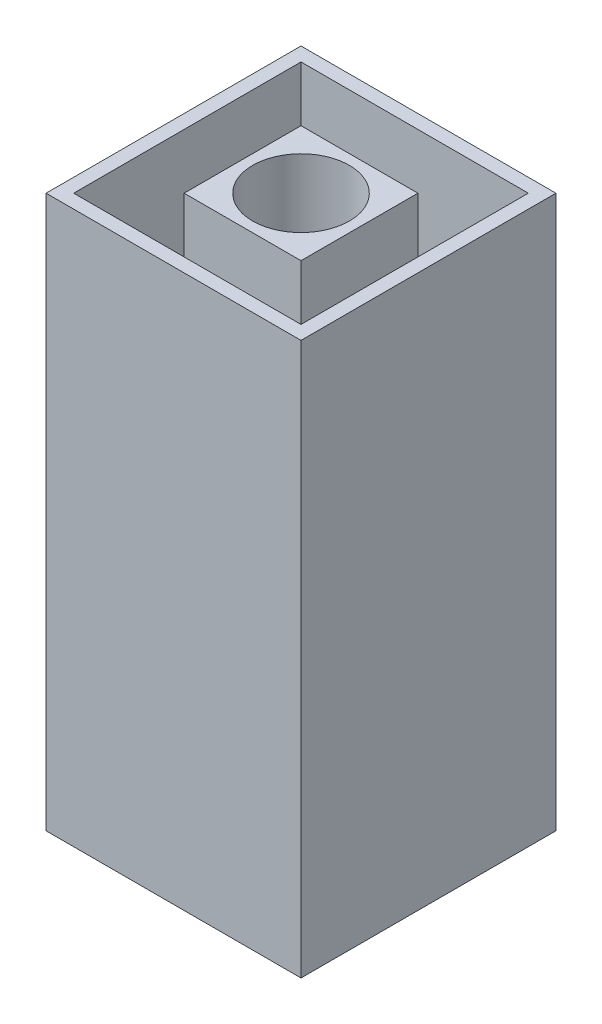
from build123d import *

# Parameters (mm, degrees)
SKETCH1_W           = 2.77
SKETCH1_H           = 2.77
BOSS_EXTRUDE1_DEPTH = 6
SKETCH2_R           = 0.525
CUT_EXTRUDE1_DEPTH  = 7.311612314
SKETCH3_W           = 2.47
SKETCH3_H           = 2.47
SKETCH3_W_2         = 1.27
SKETCH3_H_2         = 1.27
CUT_EXTRUDE2_DEPTH  = 10


with BuildPart() as part:
    # Sketch1 → Boss-Extrude1 (new body)
    with BuildSketch(Plane(origin=(0, 0, 0), x_dir=(1, 0, 0), z_dir=(0, 1, 0))):
        Rectangle(SKETCH1_W, SKETCH1_H)
    extrude(amount=BOSS_EXTRUDE1_DEPTH)

    # Sketch2 → Cut-Extrude1 (cut, through all)
    with BuildSketch(Plane(origin=(0, 6, 0), x_dir=(1, 0, 0), z_dir=(0, 1, 0))):
        with Locations(Location((0, 0, 0), (0, 0, 270))):
            Circle(SKETCH2_R)
    extrude(amount=-CUT_EXTRUDE1_DEPTH, mode=Mode.SUBTRACT)

    # Sketch3 → Cut-Extrude2 (cut)
    with BuildSketch(Plane(origin=(0, 6, 0), x_dir=(1, 0, 0), z_dir=(0, 1, 0))):
        Rectangle(SKETCH3_W, SKETCH3_H)
        Rectangle(SKETCH3_W_2, SKETCH3_H_2, mode=Mode.SUBTRACT)
    extrude(amount=-CUT_EXTRUDE2_DEPTH, mode=Mode.SUBTRACT)


with BuildPart() as cut_extrude2_piece_1:
    # of the separate pieces the step leaves, piece 1, a body of its own (cut_extrude2_pieces)
    add(part.part.solids().sort_by_distance((-1.385, 0, -1.385))[0])


with BuildPart() as cut_extrude2_piece_2:
    # of the separate pieces the step leaves, piece 2, a body of its own (cut_extrude2_pieces)
    add(part.part.solids().sort_by_distance((-0.635, 0, -0.635))[0])


solid = Compound([cut_extrude2_piece_1.part, cut_extrude2_piece_2.part])
